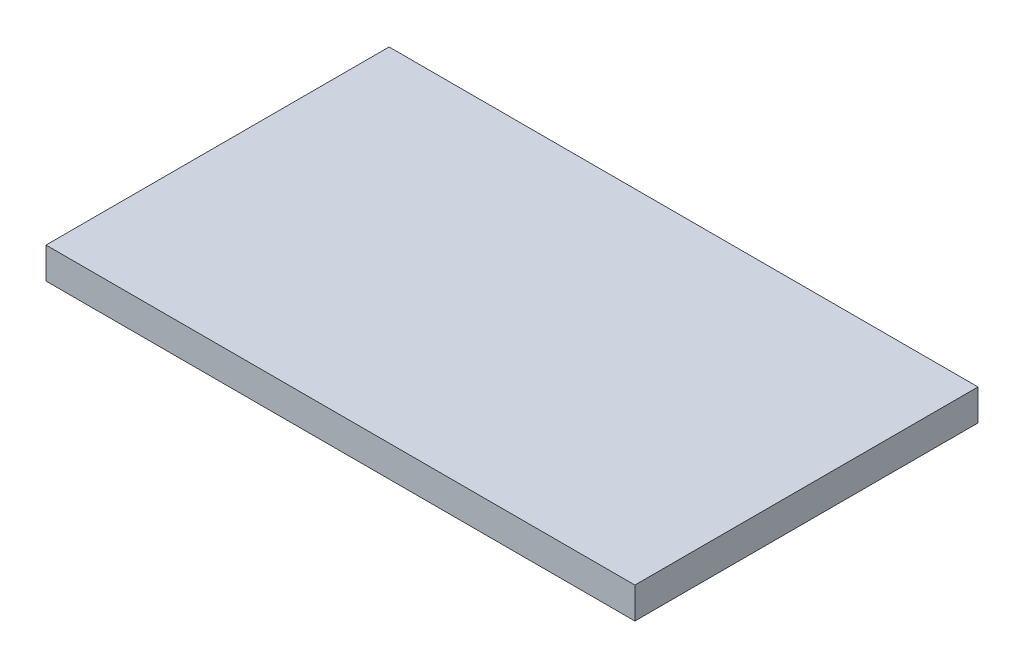
from build123d import *

# Parameters (mm, degrees)
SKETCH1_W           = 349.25
SKETCH1_H           = 31.75
BOSS_EXTRUDE1_DEPTH = 299.72


with BuildPart() as part:
    # Sketch1 → Boss-Extrude1 (new, symmetric)
    with BuildSketch(Plane(origin=(0, 0, 0), x_dir=(0, 0, -1), z_dir=(1, 0, 0))):
        Rectangle(SKETCH1_W, SKETCH1_H)
    extrude(amount=BOSS_EXTRUDE1_DEPTH, both=True)


solid = part.part
